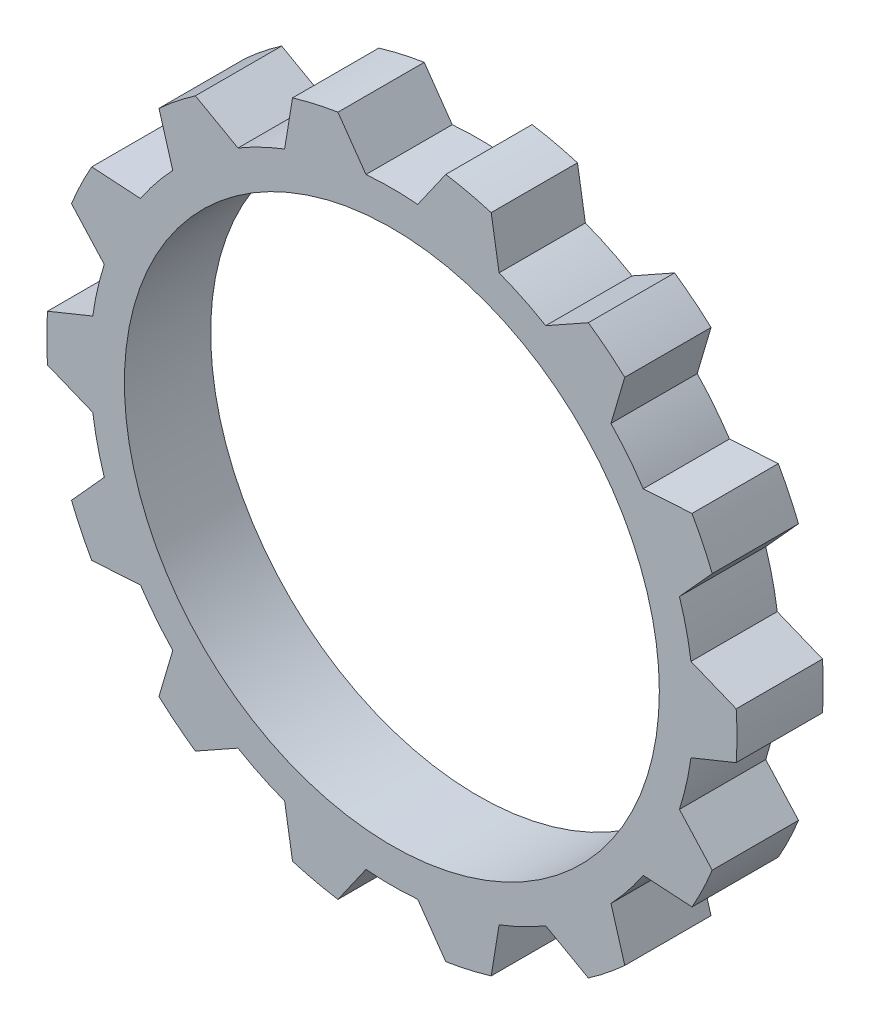
from build123d import *

# Parameters (mm, degrees)
SKETCH1_R           = 20
SKETCH1_R_2         = 15.5
BOSS_EXTRUDE1_DEPTH = 2.5
CUT_EXTRUDE1_DEPTH  = 5
CIRPATTERN1_COUNT   = 14
SKETCH6_R           = 1.5
BOSS_EXTRUDE2_DEPTH = 0.75


with BuildPart() as part:
    # Sketch1 → Boss-Extrude1 (new, symmetric)
    with BuildSketch(Plane.XY):
        Circle(SKETCH1_R)
        Circle(SKETCH1_R_2, mode=Mode.SUBTRACT)
    extrude(amount=BOSS_EXTRUDE1_DEPTH, both=True)

    # Sketch2 → Cut-Extrude1 (cut)
    with BuildSketch(Plane.XY.offset(2.5)):
        with BuildLine():
            ThreePointArc((-1.5, 17.435595774), (-0.750690999, 17.48389153), (0, 17.5))
            Line((0, 17.5), (0, 20))
            ThreePointArc((0, 20), (-1.566688393, 19.938542762), (-3.123748353, 19.754548748))
            Line((-3.123748353, 19.754548748), (-1.5, 17.435595774))
        make_face()
        with BuildLine():
            Line((0, 20), (0, 17.5))
            ThreePointArc((0, 17.5), (0.750690999, 17.48389153), (1.5, 17.435595774))
            Line((1.5, 17.435595774), (3.123748353, 19.754548748))
            ThreePointArc((3.123748353, 19.754548748), (1.566688393, 19.938542762), (0, 20))
        make_face()
    cut_extrude1 = extrude(amount=-CUT_EXTRUDE1_DEPTH, mode=Mode.SUBTRACT)

    # CirPattern1: Cut-Extrude1 ×14 about axis
    cirpattern1_axis = Axis((0, 0, 0), (0, 0, 1))
    for i in range(1, CIRPATTERN1_COUNT):
        add(cut_extrude1.rotate(cirpattern1_axis, i * 360 / CIRPATTERN1_COUNT), mode=Mode.SUBTRACT)

    # Sketch6 → Boss-Extrude2 (add)
    with BuildSketch(Plane(origin=(0, 15.5, 0), x_dir=(1, 0, 0), z_dir=(0, 1, 0))):
        with Locations(Location((0, 0, 0), (0, 0, 270))):
            Circle(SKETCH6_R)
    extrude(amount=-BOSS_EXTRUDE2_DEPTH)


solid = part.part
